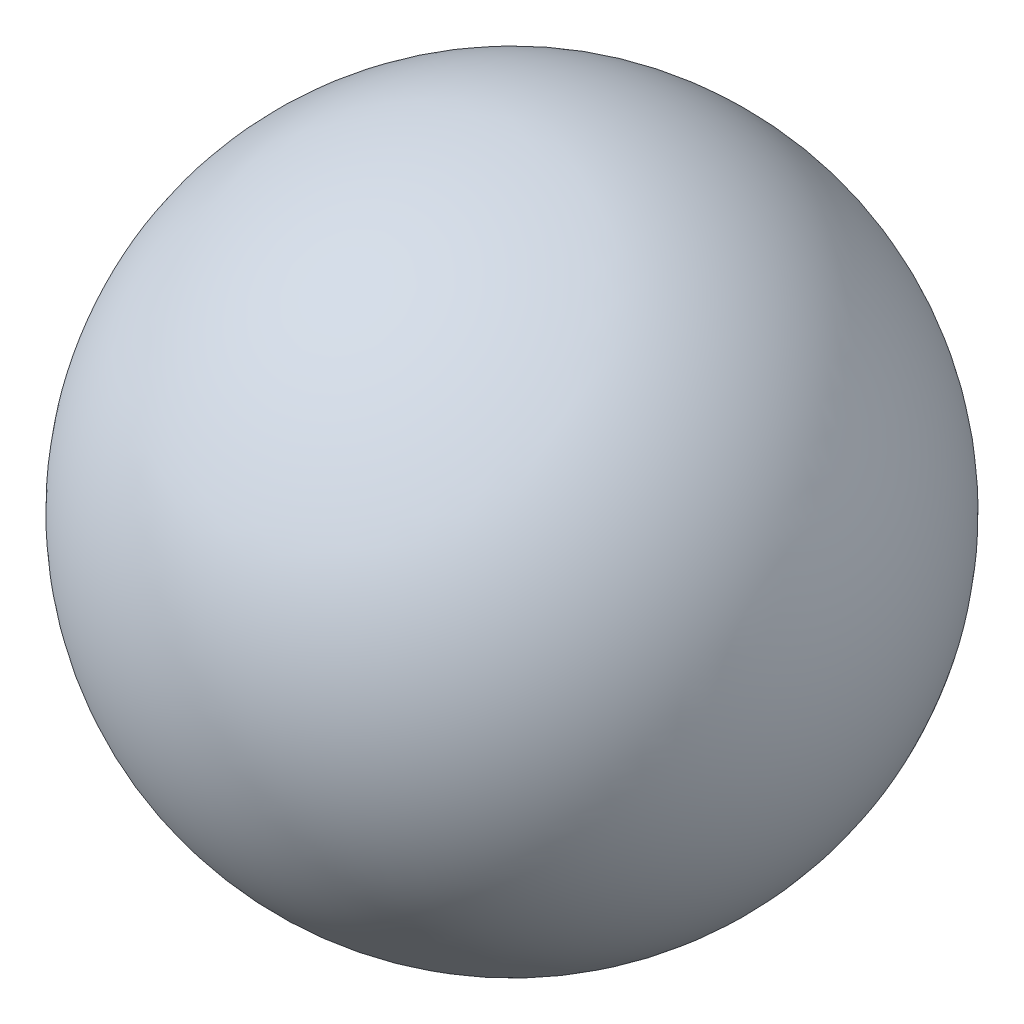
from build123d import *


with BuildPart() as part:
    # Sketch2 → Revolve2 (revolve)
    with BuildSketch(Plane(origin=(0, 0, 0), x_dir=(1, 0, 0), z_dir=(0, 1, 0))):
        with BuildLine():
            Line((980.9956505, 79.972471508), (987.324654697, 80.488422937))
            ThreePointArc((987.324654697, 80.488422937), (80.488422937, -987.324654697), (-987.324654697, -80.488422937))
            Line((-987.324654697, -80.488422937), (-980.9956505, -79.972471508))
            ThreePointArc((-980.9956505, -79.972471508), (79.972471508, -980.9956505), (980.9956505, 79.972471508))
        make_face()
    revolve(axis=Axis((-987.324654697, 0, 80.488422937), (0.9966935742956429, 0, -0.08125219355670289)))


solid = part.part
